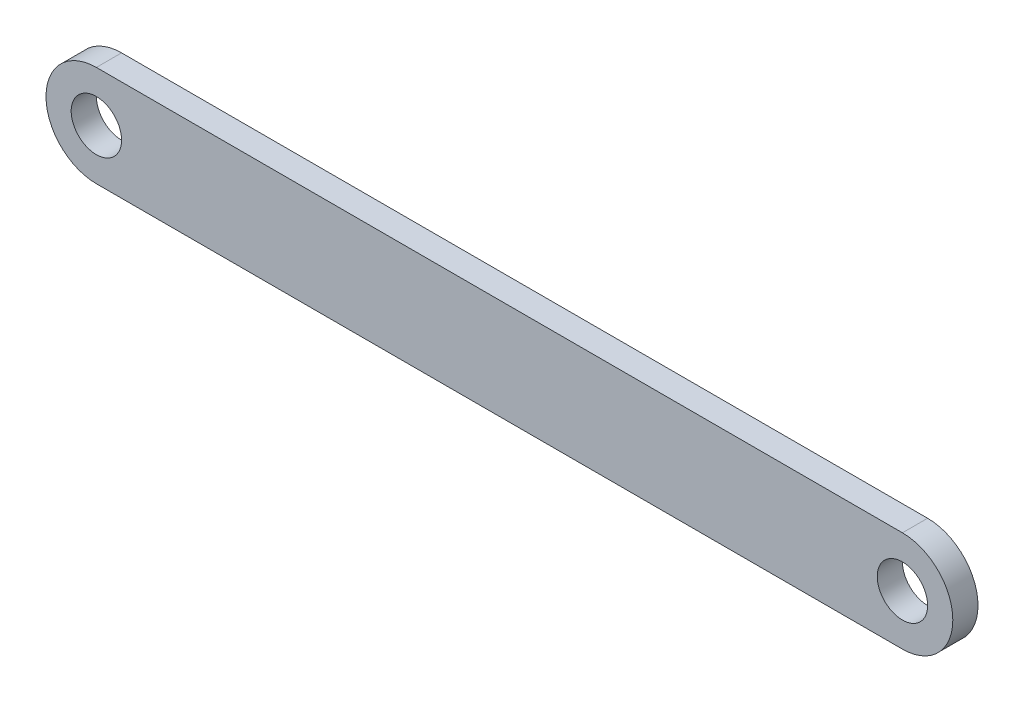
from build123d import *

# Parameters (mm, degrees)
SKETCH1_R           = 5
BOSS_EXTRUDE1_DEPTH = 5


with BuildPart() as part:
    # Sketch1 → Boss-Extrude1 (new body)
    with BuildSketch(Plane.XY):
        with BuildLine():
            Line((80, -10), (-80, -10))
            ThreePointArc((-80, -10), (-90, 0), (-80, 10))
            Line((-80, 10), (80, 10))
            ThreePointArc((80, 10), (90, 0), (80, -10))
        make_face()
        with Locations((80, 0)):
            Circle(SKETCH1_R, mode=Mode.SUBTRACT)
        with Locations((-80, 0)):
            Circle(SKETCH1_R, mode=Mode.SUBTRACT)
    extrude(amount=BOSS_EXTRUDE1_DEPTH)


solid = part.part
